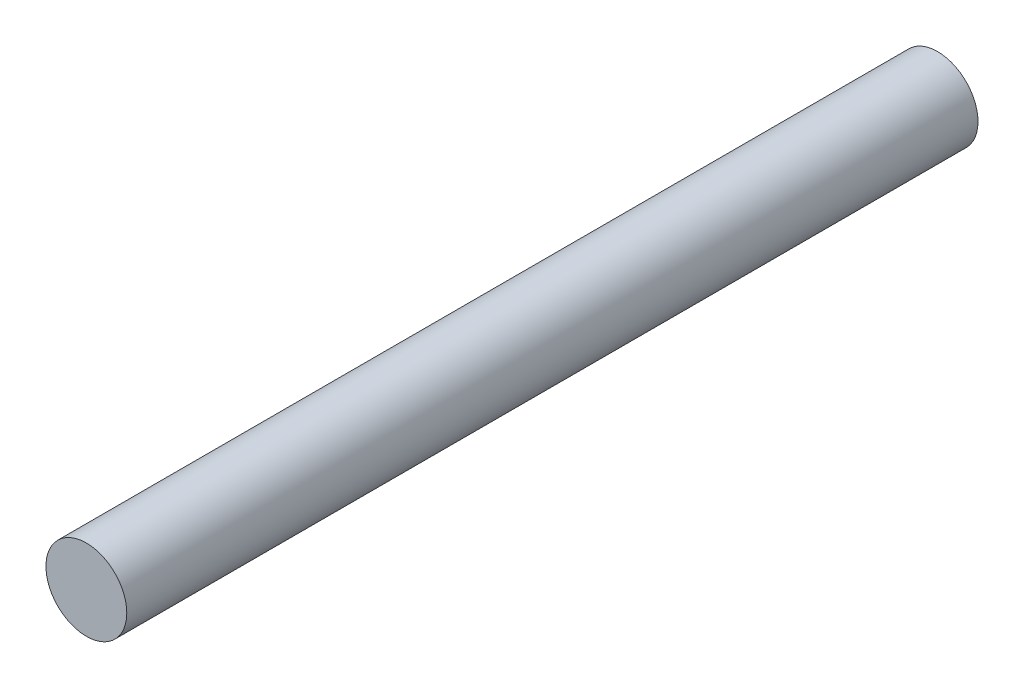
from build123d import *

# Parameters (mm, degrees)
SKETCH1_R           = 4.75
BOSS_EXTRUDE1_DEPTH = 100


with BuildPart() as part:
    # Sketch1 → Boss-Extrude1 (new body)
    with BuildSketch(Plane.XY):
        Circle(SKETCH1_R)
    extrude(amount=BOSS_EXTRUDE1_DEPTH)


solid = part.part
